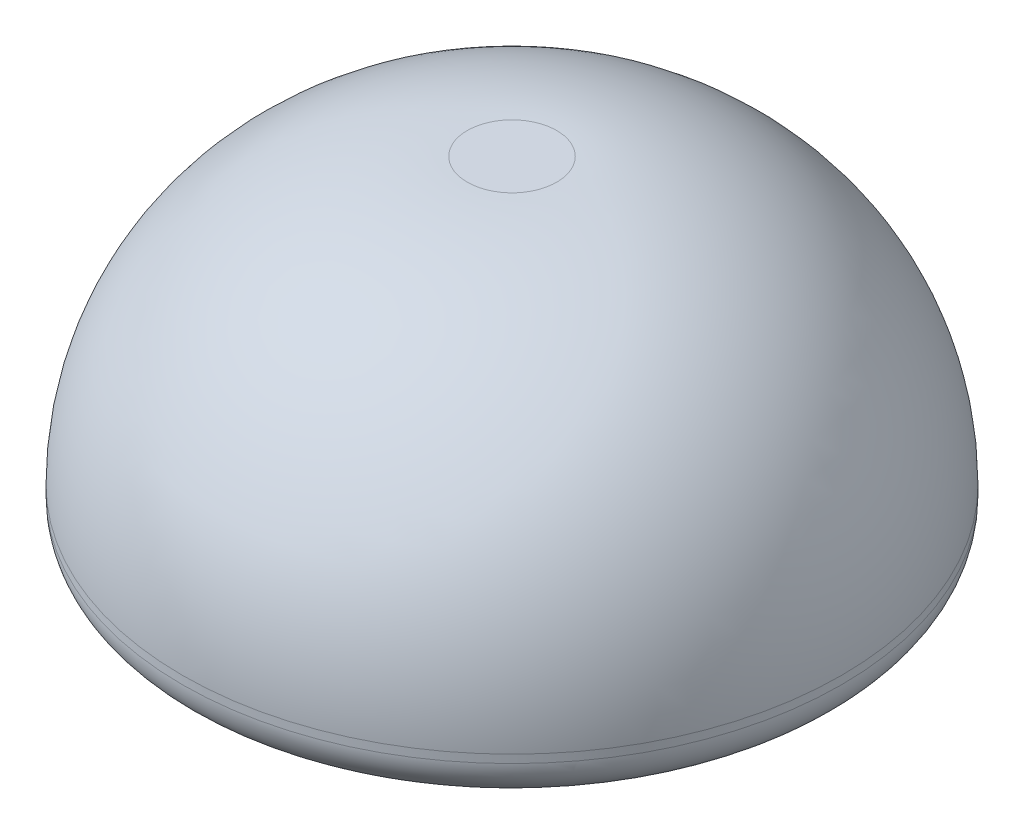
from build123d import *

# Parameters (mm, degrees)
SKETCH1_R           = 8.1
BOSS_EXTRUDE1_DEPTH = 8.2
FILLET2_R           = 7
FILLET3_R           = 1


with BuildPart() as part:
    # Sketch1 → Boss-Extrude1 (new body)
    with BuildSketch(Plane(origin=(0, 0, 0), x_dir=(1, 0, 0), z_dir=(0, 1, 0))):
        with Locations(Location((0, 0, 0), (0, 0, 270))):
            Circle(SKETCH1_R)
    extrude(amount=BOSS_EXTRUDE1_DEPTH)

    # Fillet2
    fillet2_edges = [part.edges().sort_by_distance(p)[0] for p in [
        (0, 8.2, -8.1),
    ]]
    fillet(fillet2_edges, radius=FILLET2_R)

    # Fillet3
    fillet3_edges = [part.edges().sort_by_distance(p)[0] for p in [
        (0, 0, -8.1),
    ]]
    fillet(fillet3_edges, radius=FILLET3_R)


solid = part.part
